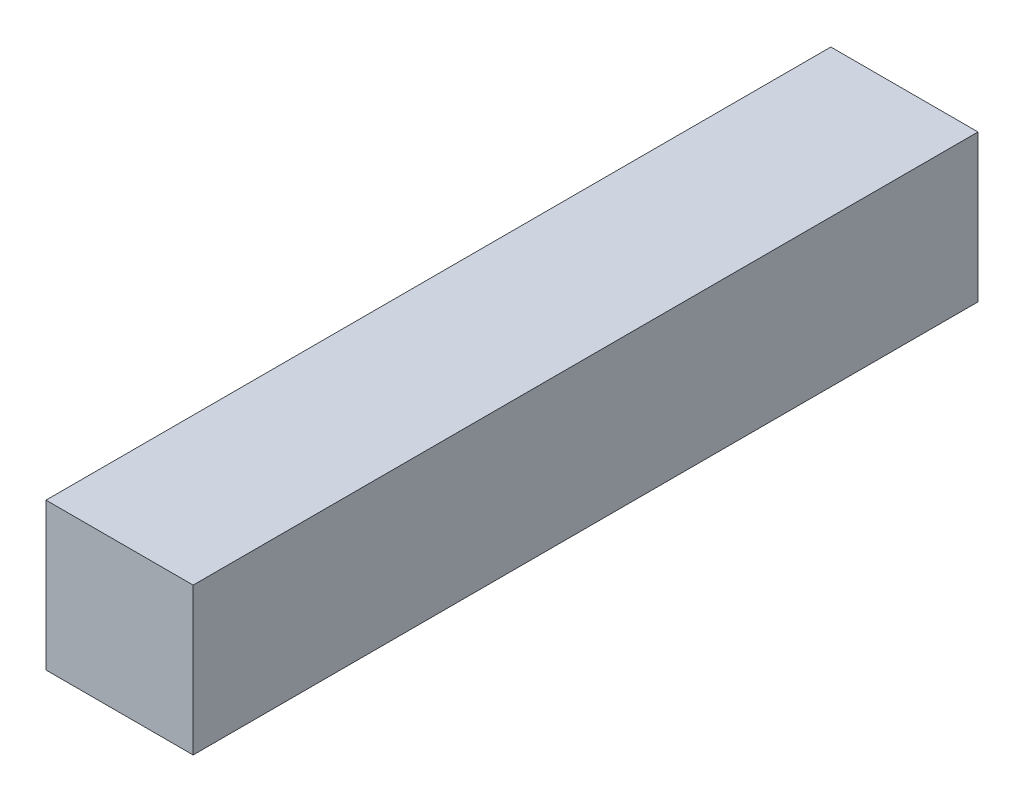
from build123d import *

# Parameters (mm, degrees)
BOSS_EXTRUDE1_DEPTH      = 6.35
BOSS_EXTRUDE1_DEPTH_BACK = 6.35
SKETCH3_W                = 2.38125
SKETCH3_H                = 2.38125


with BuildPart() as part:
    # Sketch3 → Boss-Extrude1 (new, two sides: drawn at the far end of the back side and taken through both)
    with BuildSketch(Plane.XY.offset(-BOSS_EXTRUDE1_DEPTH_BACK)):
        Rectangle(SKETCH3_W, SKETCH3_H)
    extrude(amount=BOSS_EXTRUDE1_DEPTH + BOSS_EXTRUDE1_DEPTH_BACK)


solid = part.part
